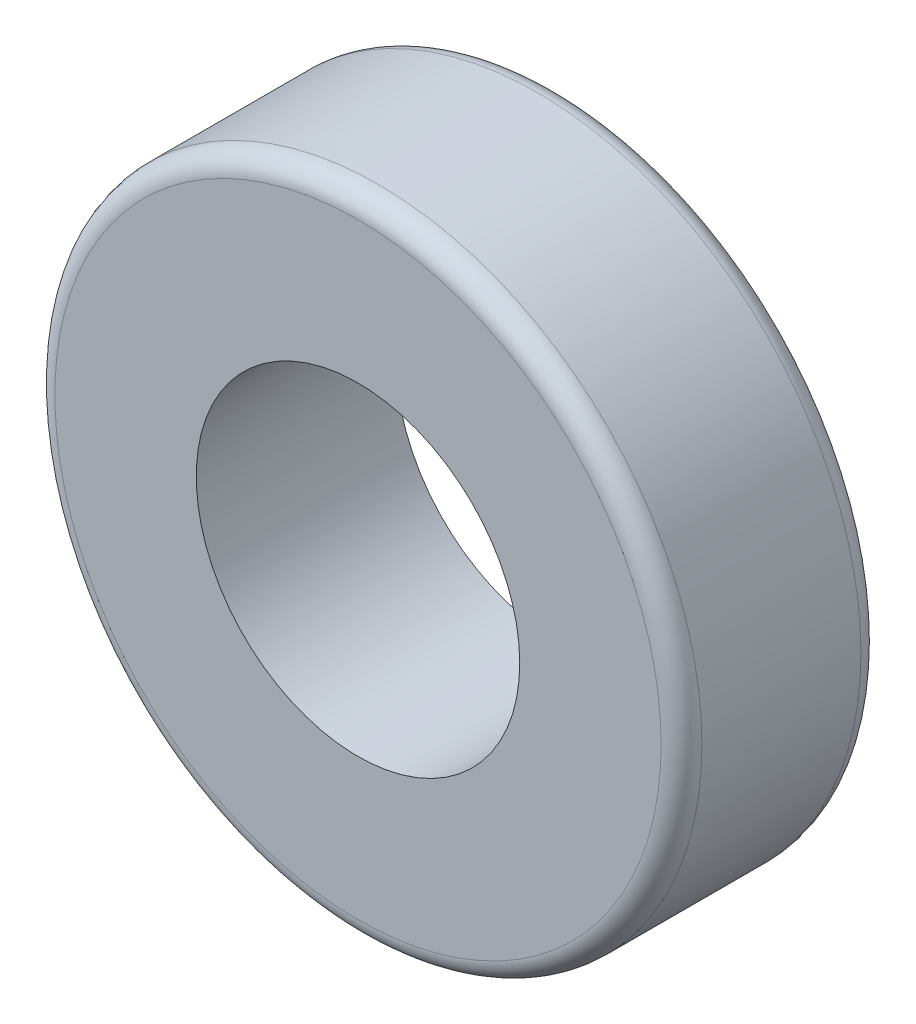
from build123d import *

# Parameters (mm, degrees)
SKETCH1_R           = 7.9375
SKETCH1_R_2         = 3.96875
BOSS_EXTRUDE1_DEPTH = 4.9022
FILLET1_R           = 0.5


with BuildPart() as part:
    # Sketch1 → Boss-Extrude1 (new body)
    with BuildSketch(Plane.XY):
        Circle(SKETCH1_R)
        Circle(SKETCH1_R_2, mode=Mode.SUBTRACT)
    extrude(amount=BOSS_EXTRUDE1_DEPTH)

    # Fillet1
    fillet1_edges = [part.edges().sort_by_distance(p)[0] for p in [
        (-7.9375, 0, 0),
        (-7.9375, 0, 4.9022),
    ]]
    fillet(fillet1_edges, radius=FILLET1_R)


solid = part.part
